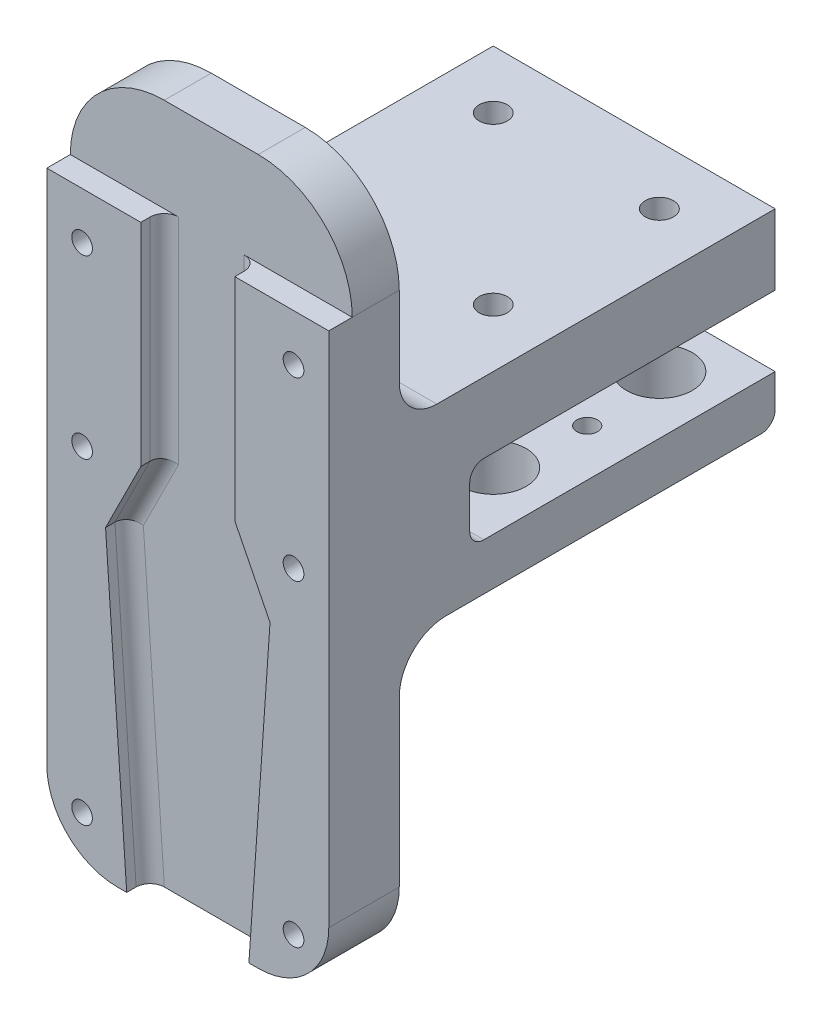
from build123d import *

# Parameters (mm, degrees)
SKETCH_8_W           = 60
SKETCH_8_H           = 60
SKETCH_8_R           = 3
EXTRUDE_7_DEPTH      = 15
SKETCH_10_W          = 60
SKETCH_10_H          = 15
EXTRUDE_8_DEPTH      = 30
SKETCH_11_W          = 60
SKETCH_11_H          = 10
EXTRUDE_9_DEPTH      = 60
SKETCH_12_W          = 60
SKETCH_12_H          = 10
EXTRUDE_10_DEPTH     = 90
SKETCH_13_W          = 60
SKETCH_13_H          = 10
EXTRUDE_11_DEPTH     = 80
SKETCH_14_R          = 7
CUT_EXTRUDE_1_DEPTH  = 10
SKETCH_15_R          = 6
CUT_EXTRUDE_2_DEPTH  = 7
SKETCH_16_R          = 2.2
CUT_EXTRUDE_3_DEPTH  = 10
SKETCH_17_R          = 3.75
CUT_EXTRUDE_4_DEPTH  = 4.5
SKETCH_18_W          = 60
SKETCH_18_H          = 15
EXTRUDE_12_DEPTH     = 15
FILLET_1_R           = 3
FILLET_2_R           = 10
FILLET_3_R           = 3
FILLET_4_R           = 8
SKETCH_19_W          = 20
SKETCH_19_H          = 45
EXTRUDE_13_DEPTH     = 5
SKETCH_20_W          = 60
SKETCH_20_H          = 5
CUT_EXTRUDE_5_DEPTH  = 131.766968306
FILLET_5_R           = 3
FILLET_6_R           = 15
CUT_EXTRUDE_6_DEPTH  = 131.958008537
CUT_EXTRUDE_7_DEPTH  = 112.130553854
CUT_EXTRUDE_8_DEPTH  = 4.5
CUT_EXTRUDE_9_DEPTH  = 15
SKETCH_26_R          = 4.2
CUT_EXTRUDE_10_DEPTH = 15
FILLET_7_R           = 20


with BuildPart() as part:
    # 草图8 → 凸台-拉伸7 (new body)
    with BuildSketch(Plane(origin=(0, 0, 0), x_dir=(1, 0, 0), z_dir=(0, 1, 0))):
        Rectangle(SKETCH_8_W, SKETCH_8_H)
        with Locations(Location((17.67766953, 17.67766953, 0), (0, 0, 270))):
            Circle(SKETCH_8_R, mode=Mode.SUBTRACT)
        with Locations(Location((-17.67766953, 17.67766953, 0), (0, 0, 270))):
            Circle(SKETCH_8_R, mode=Mode.SUBTRACT)
        with Locations(Location((-17.67766953, -17.67766953, 0), (0, 0, 270))):
            Circle(SKETCH_8_R, mode=Mode.SUBTRACT)
        with Locations(Location((17.67766953, -17.67766953, 0), (0, 0, 270))):
            Circle(SKETCH_8_R, mode=Mode.SUBTRACT)
    extrude(amount=EXTRUDE_7_DEPTH)

    # 草图10 → 凸台-拉伸8 (add)
    with BuildSketch(Plane.XY.offset(30)):
        with Locations((0, 7.5)):
            Rectangle(SKETCH_10_W, SKETCH_10_H)
    extrude(amount=EXTRUDE_8_DEPTH)

    # 草图11 → 凸台-拉伸9 (add)
    with BuildSketch(Plane.XZ):
        with Locations((0, 55)):
            Rectangle(SKETCH_11_W, SKETCH_11_H)
    extrude(amount=-EXTRUDE_9_DEPTH)

    # 草图12 → 凸台-拉伸10 (add)
    with BuildSketch(Plane(origin=(0, 0, 0), x_dir=(-1, 0, 0), z_dir=(0, -1, 0))):
        with Locations((0, -55)):
            Rectangle(SKETCH_12_W, SKETCH_12_H)
    extrude(amount=EXTRUDE_10_DEPTH)

    # 草图13 → 凸台-拉伸11 (add)
    with BuildSketch(Plane(origin=(0, 0, 50), x_dir=(-1, 0, 0), z_dir=(0, 0, -1))):
        with Locations((0, -20)):
            Rectangle(SKETCH_13_W, SKETCH_13_H)
    extrude(amount=EXTRUDE_11_DEPTH)

    # 草图14 → 切除-拉伸1 (cut)
    with BuildSketch(Plane.XZ.offset(25)):
        with Locations((17.67766953, 17.67766953)):
            Circle(SKETCH_14_R)
        with Locations((17.67766953, -17.67766953)):
            Circle(SKETCH_14_R)
        with Locations((-17.67766953, -17.67766953)):
            Circle(SKETCH_14_R)
        with Locations((-17.67766953, 17.67766953)):
            Circle(SKETCH_14_R)
    extrude(amount=-CUT_EXTRUDE_1_DEPTH, mode=Mode.SUBTRACT)

    # 草图15 → 切除-拉伸2 (cut)
    with BuildSketch(Plane.XZ):
        with Locations(Location((-17.67766953, 17.67766953, 0), (0, 0, 270))):
            Circle(SKETCH_15_R)
        with Locations(Location((-17.67766953, -17.67766953, 0), (0, 0, 270))):
            Circle(SKETCH_15_R)
        with Locations(Location((17.67766953, -17.67766953, 0), (0, 0, 270))):
            Circle(SKETCH_15_R)
        with Locations(Location((17.67766953, 17.67766953, 0), (0, 0, 270))):
            Circle(SKETCH_15_R)
    extrude(amount=-CUT_EXTRUDE_2_DEPTH, mode=Mode.SUBTRACT)

    # 草图16 → 切除-拉伸3 (cut)
    with BuildSketch(Plane(origin=(0, -25, 0), x_dir=(-1, 0, 0), z_dir=(0, -1, 0))):
        with Locations(Location((-20, 0, 0), (0, 0, 180))):
            Circle(SKETCH_16_R)
        with Locations(Location((0, 20, 0), (0, 0, 180))):
            Circle(SKETCH_16_R)
        with Locations(Location((20, 0, 0), (0, 0, 180))):
            Circle(SKETCH_16_R)
        with Locations(Location((0, -20, 0), (0, 0, 180))):
            Circle(SKETCH_16_R)
    extrude(amount=-CUT_EXTRUDE_3_DEPTH, mode=Mode.SUBTRACT)

    # 草图17 → 切除-拉伸4 (cut)
    with BuildSketch(Plane.XZ.offset(25)):
        with Locations((20, 0)):
            Circle(SKETCH_17_R)
        with Locations((0, -20)):
            Circle(SKETCH_17_R)
        with Locations((0, 20)):
            Circle(SKETCH_17_R)
        with Locations((-20, 0)):
            Circle(SKETCH_17_R)
    extrude(amount=-CUT_EXTRUDE_4_DEPTH, mode=Mode.SUBTRACT)

    # 草图18 → 凸台-拉伸12 (add)
    with BuildSketch(Plane(origin=(0, 0, 50), x_dir=(-1, 0, 0), z_dir=(0, 0, -1))):
        with Locations((0, -7.5)):
            Rectangle(SKETCH_18_W, SKETCH_18_H)
    extrude(amount=EXTRUDE_12_DEPTH)

    # 圆角1
    fillet_1_edges = [part.edges().sort_by_distance(p)[0] for p in [
        (0, -25, -30),
    ]]
    fillet(fillet_1_edges, radius=FILLET_1_R)

    # 圆角2
    fillet_2_edges = [part.edges().sort_by_distance(p)[0] for p in [
        (0, -25, 50),
    ]]
    fillet(fillet_2_edges, radius=FILLET_2_R)

    # 圆角3
    fillet_3_edges = [part.edges().sort_by_distance(p)[0] for p in [
        (0, -15, 35),
        (0, 0, 35),
    ]]
    fillet(fillet_3_edges, radius=FILLET_3_R)

    # 圆角4
    fillet_4_edges = [part.edges().sort_by_distance(p)[0] for p in [
        (0, 15, 50),
    ]]
    fillet(fillet_4_edges, radius=FILLET_4_R)

    # 草图19 → 凸台-拉伸13 (add)
    with BuildSketch(Plane.XY.offset(60)):
        Polygon((30, -5), (10, -5), (17.5, -20), (17.5, -85), (30, -85), align=None)
        with Locations((20, 17.5)):
            Rectangle(SKETCH_19_W, SKETCH_19_H)
        with Locations((-20, 17.5)):
            Rectangle(SKETCH_19_W, SKETCH_19_H)
        Polygon((-17.5, -20), (-10, -5), (-30, -5), (-30, -85), (-17.5, -85), align=None)
        Polygon((-17.5, -85), (-13, -85), (-17.5, -20), align=None)
        Polygon((17.5, -20), (13, -85), (17.5, -85), align=None)
    extrude(amount=EXTRUDE_13_DEPTH)

    # 草图20 → 切除-拉伸5 (cut, through all)
    with BuildSketch(Plane.XY.offset(60)):
        with Locations((0, -87.5)):
            Rectangle(SKETCH_20_W, SKETCH_20_H)
    extrude(amount=-CUT_EXTRUDE_5_DEPTH, mode=Mode.SUBTRACT)

    # 圆角5
    fillet_5_edges = [part.edges().sort_by_distance(p)[0] for p in [
        (-10, 17.5, 60),
        (-13.75, -12.5, 60),
        (-15.25, -52.5, 60),
        (10, 17.5, 60),
        (15.25, -52.5, 60),
        (13.75, -12.5, 60),
    ]]
    fillet(fillet_5_edges, radius=FILLET_5_R)

    # 圆角6
    fillet_6_edges = [part.edges().sort_by_distance(p)[0] for p in [
        (-30, -85, 57.5),
        (30, -85, 57.5),
    ]]
    fillet(fillet_6_edges, radius=FILLET_6_R)

    # 草图22 → 切除-拉伸6 (cut, through all)
    with BuildSketch(Plane.XY.offset(65)):
        with BuildLine():
            ThreePointArc((-20.3, -75), (-20.944365081, -73.444365081), (-22.5, -72.8))
            Line((-22.5, -72.8), (-22.5, -75))
            Line((-22.5, -75), (-20.3, -75))
        make_face()
        with BuildLine():
            Line((-22.5, -75), (-22.5, -72.8))
            ThreePointArc((-22.5, -72.8), (-24.055634919, -76.555634919), (-20.3, -75))
            Line((-20.3, -75), (-22.5, -75))
        make_face()
        with BuildLine():
            ThreePointArc((24.7, -75), (24.055634919, -73.444365081), (22.5, -72.8))
            Line((22.5, -72.8), (22.5, -75))
            Line((22.5, -75), (20.3, -75))
            ThreePointArc((20.3, -75), (22.5, -77.2), (24.7, -75))
        make_face()
        with BuildLine():
            Line((22.5, -75), (22.5, -72.8))
            ThreePointArc((22.5, -72.8), (20.944365081, -73.444365081), (20.3, -75))
            Line((20.3, -75), (22.5, -75))
        make_face()
        with BuildLine():
            ThreePointArc((-20.3, 30), (-24.055634919, 31.555634919), (-22.5, 27.8))
            Line((-22.5, 27.8), (-22.5, 30))
            Line((-22.5, 30), (-20.3, 30))
        make_face()
        with BuildLine():
            Line((-22.5, 30), (-22.5, 27.8))
            ThreePointArc((-22.5, 27.8), (-20.944365081, 28.444365081), (-20.3, 30))
            Line((-20.3, 30), (-22.5, 30))
        make_face()
        with BuildLine():
            ThreePointArc((20.3, 30), (20.944365081, 28.444365081), (22.5, 27.8))
            Line((22.5, 27.8), (22.5, 30))
            Line((22.5, 30), (20.3, 30))
        make_face()
        with BuildLine():
            Line((22.5, 30), (22.5, 27.8))
            ThreePointArc((22.5, 27.8), (24.055634919, 28.444365081), (24.7, 30))
            ThreePointArc((24.7, 30), (22.5, 32.2), (20.3, 30))
            Line((20.3, 30), (22.5, 30))
        make_face()
    extrude(amount=-CUT_EXTRUDE_6_DEPTH, mode=Mode.SUBTRACT)

    # 草图23 → 切除-拉伸7 (cut, through all)
    with BuildSketch(Plane(origin=(0, 0, 35), x_dir=(-1, 0, 0), z_dir=(0, 0, -1))):
        with BuildLine():
            ThreePointArc((22.392444444, -9.697369291), (24.017131797, -9.093207805), (24.7, -7.5))
            Line((24.7, -7.5), (22.5, -7.5))
            ThreePointArc((22.5, -7.5), (22.473095025, -8.6), (22.392444444, -9.697369291))
        make_face()
        with BuildLine():
            Line((22.5, -7.5), (24.7, -7.5))
            ThreePointArc((24.7, -7.5), (24.017131797, -5.906792195), (22.392444444, -5.302630709))
            ThreePointArc((22.392444444, -5.302630709), (22.473095025, -6.4), (22.5, -7.5))
        make_face()
        with BuildLine():
            ThreePointArc((22.392444444, -9.697369291), (22.473095025, -8.6), (22.5, -7.5))
            Line((22.5, -7.5), (20.3, -7.5))
            ThreePointArc((20.3, -7.5), (20.906792195, -9.017131797), (22.392444444, -9.697369291))
        make_face()
        with BuildLine():
            Line((20.3, -7.5), (22.5, -7.5))
            ThreePointArc((22.5, -7.5), (22.473095025, -6.4), (22.392444444, -5.302630709))
            ThreePointArc((22.392444444, -5.302630709), (20.906792195, -5.982868203), (20.3, -7.5))
        make_face()
        with BuildLine():
            ThreePointArc((-22.392444444, -9.697369291), (-20.906792195, -9.017131797), (-20.3, -7.5))
            Line((-20.3, -7.5), (-22.5, -7.5))
            ThreePointArc((-22.5, -7.5), (-22.473095025, -8.6), (-22.392444444, -9.697369291))
        make_face()
        with BuildLine():
            Line((-22.5, -7.5), (-20.3, -7.5))
            ThreePointArc((-20.3, -7.5), (-20.906792195, -5.982868203), (-22.392444444, -5.302630709))
            ThreePointArc((-22.392444444, -5.302630709), (-22.473095025, -6.4), (-22.5, -7.5))
        make_face()
        with BuildLine():
            ThreePointArc((-22.5, -7.5), (-22.473095025, -6.4), (-22.392444444, -5.302630709))
            ThreePointArc((-22.392444444, -5.302630709), (-24.017131797, -5.906792195), (-24.7, -7.5))
            Line((-24.7, -7.5), (-22.5, -7.5))
        make_face()
        with BuildLine():
            ThreePointArc((-24.7, -7.5), (-24.017131797, -9.093207805), (-22.392444444, -9.697369291))
            ThreePointArc((-22.392444444, -9.697369291), (-22.473095025, -8.6), (-22.5, -7.5))
            Line((-22.5, -7.5), (-24.7, -7.5))
        make_face()
    extrude(amount=-CUT_EXTRUDE_7_DEPTH, mode=Mode.SUBTRACT)

    # 草图24 → 切除-拉伸8 (cut)
    with BuildSketch(Plane(origin=(0, 0, 50), x_dir=(-1, 0, 0), z_dir=(0, 0, -1))):
        Polygon((26.7, 30), (24.6, 33.637306696), (20.4, 33.637306696), (18.3, 30), (20.4, 26.362693304), (24.6, 26.362693304), align=None)
        Polygon((-26.7, 30), (-24.6, 26.362693304), (-20.4, 26.362693304), (-18.3, 30), (-20.4, 33.637306696), (-24.6, 33.637306696), align=None)
        Polygon((18.3, -7.5), (20.4, -11.137306696), (24.6, -11.137306696), (26.7, -7.5), (24.6, -3.862693304), (20.4, -3.862693304), align=None)
        Polygon((-26.7, -7.5), (-24.6, -11.137306696), (-20.4, -11.137306696), (-18.3, -7.5), (-20.4, -3.862693304), (-24.6, -3.862693304), align=None)
        Polygon((18.3, -75), (20.4, -78.637306696), (24.6, -78.637306696), (26.7, -75), (24.6, -71.362693304), (20.4, -71.362693304), align=None)
        Polygon((-18.3, -75), (-20.4, -71.362693304), (-24.6, -71.362693304), (-26.7, -75), (-24.6, -78.637306696), (-20.4, -78.637306696), align=None)
    extrude(amount=-CUT_EXTRUDE_8_DEPTH, mode=Mode.SUBTRACT)

    # 草图25 → 切除-拉伸9 (cut)
    with BuildSketch(Plane(origin=(0, 0, 35), x_dir=(-1, 0, 0), z_dir=(0, 0, -1))):
        Polygon((18.3, -7.5), (20.4, -11.137306696), (24.6, -11.137306696), (26.7, -7.5), (24.6, -3.862693304), (20.4, -3.862693304), align=None)
        Polygon((-18.3, -7.5), (-20.4, -3.862693304), (-24.6, -3.862693304), (-26.7, -7.5), (-24.6, -11.137306696), (-20.4, -11.137306696), align=None)
    extrude(amount=-CUT_EXTRUDE_9_DEPTH, mode=Mode.SUBTRACT)

    # 草图26 → 切除-拉伸10 (cut)
    with BuildSketch(Plane(origin=(0, 0, 35), x_dir=(-1, 0, 0), z_dir=(0, 0, -1))):
        with Locations((22.5, -7.5)):
            Circle(SKETCH_26_R)
        with Locations((-22.5, -7.5)):
            Circle(SKETCH_26_R)
    extrude(amount=-CUT_EXTRUDE_10_DEPTH, mode=Mode.SUBTRACT)

    # 圆角7
    fillet_7_edges = [part.edges().sort_by_distance(p)[0] for p in [
        (-30, 60, 55),
        (30, 60, 55),
    ]]
    fillet(fillet_7_edges, radius=FILLET_7_R)


solid = part.part
